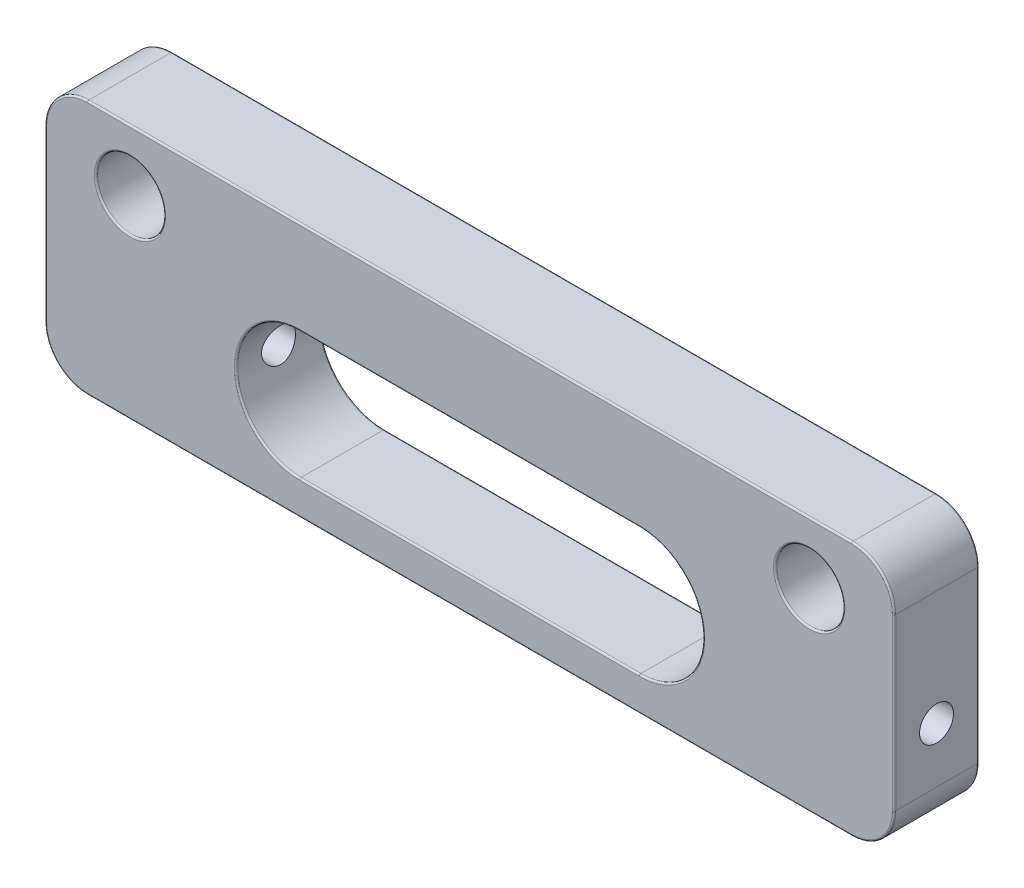
from build123d import *

# Parameters (mm, degrees)
SKETCH1_W           = 100
SKETCH1_H           = 30
SKETCH1_R           = 4
BOSS_EXTRUDE1_DEPTH = 5
FILLET1_R           = 5
FILLET2_R           = 0.2
SKETCH3_R           = 2
CUT_EXTRUDE1_DEPTH  = 102.242283662


with BuildPart() as part:
    # Sketch1 → Boss-Extrude1 (new, symmetric)
    with BuildSketch(Plane.XY):
        Rectangle(SKETCH1_W, SKETCH1_H)
        with Locations((40, 7.823877396)):
            Circle(SKETCH1_R, mode=Mode.SUBTRACT)
        with Locations((-40, 7.823877396)):
            Circle(SKETCH1_R, mode=Mode.SUBTRACT)
        with BuildLine():
            Line((20, -11), (-20, -11))
            ThreePointArc((-20, -11), (-27.5, -3.5), (-20, 4))
            Line((-20, 4), (20, 4))
            ThreePointArc((20, 4), (27.5, -3.5), (20, -11))
        make_face(mode=Mode.SUBTRACT)
    extrude(amount=BOSS_EXTRUDE1_DEPTH, both=True)

    # Fillet1
    fillet1_edges = [part.edges().sort_by_distance(p)[0] for p in [
        (50, -15, 0),
        (50, 15, 0),
        (-50, -15, 0),
        (-50, 15, 0),
    ]]
    fillet(fillet1_edges, radius=FILLET1_R)

    # Fillet2
    fillet2_edges = [part.edges().sort_by_distance(p)[0] for p in [
        (-44, 7.823877396, -5),
        (-27.5, -3.5, -5),
        (0, 4, -5),
        (27.5, -3.5, -5),
        (0, -11, -5),
        (48.535533906, 13.535533906, -5),
        (0, 15, -5),
        (-48.535533906, 13.535533906, -5),
        (-50, 0, -5),
        (-48.535533906, -13.535533906, -5),
        (0, -15, -5),
        (48.535533906, -13.535533906, -5),
        (50, 0, -5),
        (36, 7.823877396, -5),
        (-44, 7.823877396, 5),
        (0, 4, 5),
        (-27.5, -3.5, 5),
        (0, -11, 5),
        (27.5, -3.5, 5),
        (-48.535533906, -13.535533906, 5),
        (-50, 0, 5),
        (-48.535533906, 13.535533906, 5),
        (0, 15, 5),
        (48.535533906, 13.535533906, 5),
        (50, 0, 5),
        (48.535533906, -13.535533906, 5),
        (0, -15, 5),
        (36, 7.823877396, 5),
    ]]
    fillet(fillet2_edges, radius=FILLET2_R)

    # Sketch3 → Cut-Extrude1 (cut, through all)
    with BuildSketch(Plane(origin=(50, 0, 0), x_dir=(0, 0, -1), z_dir=(1, 0, 0))):
        with Locations((0, -3.5)):
            Circle(SKETCH3_R)
    extrude(amount=-CUT_EXTRUDE1_DEPTH, mode=Mode.SUBTRACT)


solid = part.part
